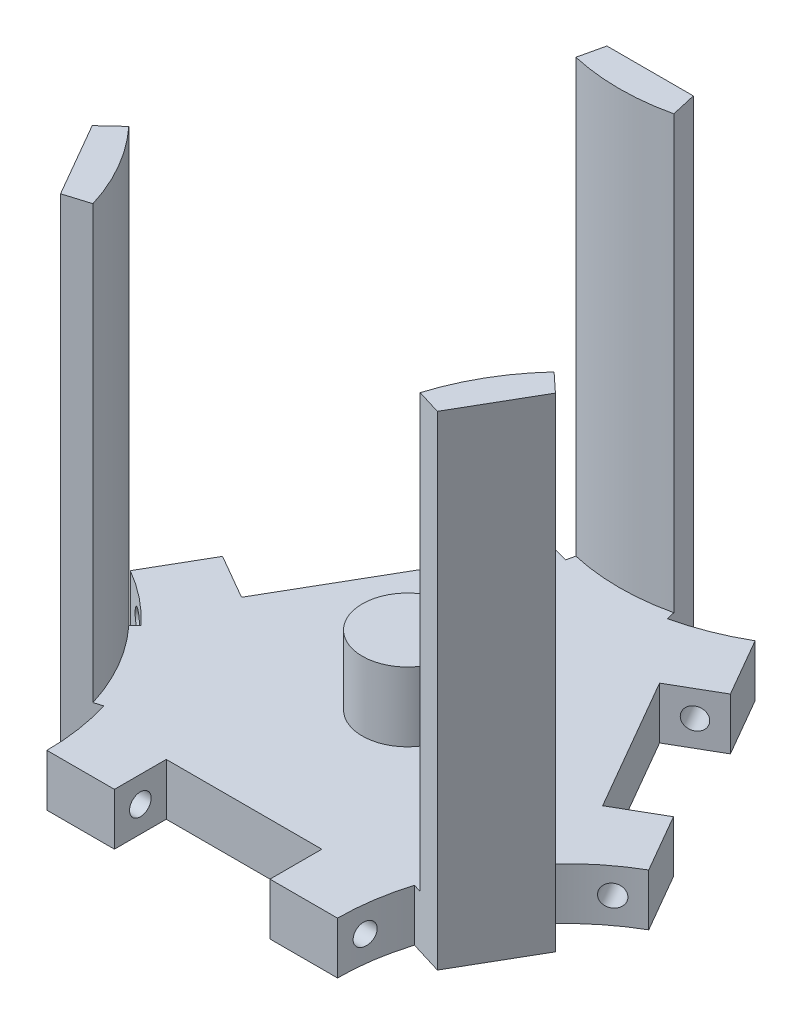
from build123d import *

# Parameters (mm, degrees)
BOSS_EXTRUDE1_DEPTH     = 3
SKETCH2_R               = 2.625
BOSS_EXTRUDE2_DEPTH     = 4
SKETCH3_W               = 9
SKETCH3_H               = 3
CUT_EXTRUDE1_DEPTH      = 46.717380795
CUT_EXTRUDE2_DEPTH      = 47.391760164
CUT_EXTRUDE2_DEPTH_BACK = 47.391760164
SKETCH4_R               = 0.625
CUT_EXTRUDE3_DEPTH      = 33.475581638
CUT_EXTRUDE3_DEPTH_BACK = 33.475581638
SKETCH5_R               = 0.625
CUT_EXTRUDE4_DEPTH      = 34.635958629
CUT_EXTRUDE4_DEPTH_BACK = 34.635958629
SKETCH6_R               = 0.625
BOSS_EXTRUDE3_DEPTH     = 25
SCALE1_SCALE            = 1.3


with BuildPart() as part:
    # Sketch1 → Boss-Extrude1 (new body)
    with BuildSketch(Plane(origin=(0, 0, 0), x_dir=(1, 0, 0), z_dir=(0, 1, 0))):
        with BuildLine():
            Line((6.591682084, 11.417128277), (15, 25.980762114))
            ThreePointArc((15, 25.980762114), (16.768876635, 25.128389411), (18.644755802, 24.548267761))
            Line((18.644755802, 24.548267761), (19.091682084, 26.497692522))
            Line((19.091682084, 26.497692522), (24.091682084, 26.497692522))
            Line((24.091682084, 26.497692522), (24.538608366, 24.548267761))
            ThreePointArc((24.538608366, 24.548267761), (26.414487532, 25.128389411), (28.183364168, 25.980762114))
            Line((28.183364168, 25.980762114), (36.591682084, 11.417128277))
            ThreePointArc((36.591682084, 11.417128277), (34.969067352, 10.311422526), (33.528727683, 8.976924338))
            Line((33.528727683, 8.976924338), (34.993515908, 7.615162444))
            Line((34.993515908, 7.615162444), (32.493515908, 3.285035425))
            Line((32.493515908, 3.285035425), (30.581801401, 3.872698291))
            ThreePointArc((30.581801401, 3.872698291), (30.146261903, 1.958078454), (30, 0))
            Line((30, 0), (13.183364168, 0))
            ThreePointArc((13.183364168, 0), (13.037102264, 1.958078454), (12.601562767, 3.872698291))
            Line((12.601562767, 3.872698291), (10.68984826, 3.285035425))
            Line((10.68984826, 3.285035425), (8.18984826, 7.615162444))
            Line((8.18984826, 7.615162444), (9.654636485, 8.976924338))
            ThreePointArc((9.654636485, 8.976924338), (8.214296816, 10.311422526), (6.591682084, 11.417128277))
        make_face()
    extrude(amount=BOSS_EXTRUDE1_DEPTH)

    # Sketch2 → Boss-Extrude2 (add)
    with BuildSketch(Plane(origin=(0, 3, 0), x_dir=(1, 0, 0), z_dir=(0, 1, 0))):
        with Locations(Location((21.591682084, 12.465963463, 0), (0, 0, 90))):
            Circle(SKETCH2_R)
    extrude(amount=BOSS_EXTRUDE2_DEPTH)

    # Sketch3 → Cut-Extrude1 (cut, through all)
    with BuildSketch(Plane.XZ):
        with Locations((21.591682084, -1.5)):
            Rectangle(SKETCH3_W, SKETCH3_H)
        Polygon((8.545841042, -14.801830878), (13.045841042, -22.596059512), (15.643917253, -21.096059512), (11.143917253, -13.301830878), align=None)
        Polygon((34.637523126, -14.801830878), (32.039446914, -13.301830878), (27.539446914, -21.096059512), (30.137523126, -22.596059512), align=None)
    extrude(amount=-CUT_EXTRUDE1_DEPTH, mode=Mode.SUBTRACT)

    # Sketch4 → Cut-Extrude2 (cut, two sides: drawn at the far end of the back side and taken through both)
    with BuildSketch(Plane(origin=(2.25, 0, 3.897114317), x_dir=(-0.8660254037844389, 0, 0.4999999999999997), z_dir=(-0.4999999999999997, 0, -0.8660254037844389)).offset(-CUT_EXTRUDE2_DEPTH_BACK)):
        with Locations((-35.89789039, 1.5)):
            Circle(SKETCH4_R)
    extrude(amount=CUT_EXTRUDE2_DEPTH + CUT_EXTRUDE2_DEPTH_BACK, mode=Mode.SUBTRACT)

    # Sketch5 → Cut-Extrude3 (cut, two sides: drawn at the far end of the back side and taken through both)
    with BuildSketch(Plane(origin=(8.545841042, 0, -14.801830878), x_dir=(-0.8660254037844383, 0, -0.5000000000000008), z_dir=(0.5000000000000007, 0, -0.8660254037844382)).offset(-CUT_EXTRUDE3_DEPTH_BACK)):
        with Locations((-1.5, 1.5)):
            Circle(SKETCH5_R)
    extrude(amount=CUT_EXTRUDE3_DEPTH + CUT_EXTRUDE3_DEPTH_BACK, mode=Mode.SUBTRACT)

    # Sketch6 → Cut-Extrude4 (cut, two sides: drawn at the far end of the back side and taken through both)
    with BuildSketch(Plane.ZY.offset(-26.091682084).offset(-CUT_EXTRUDE4_DEPTH_BACK)):
        with Locations((-1.5, 1.5)):
            Circle(SKETCH6_R)
    extrude(amount=CUT_EXTRUDE4_DEPTH + CUT_EXTRUDE4_DEPTH_BACK, mode=Mode.SUBTRACT)

    # Sketch7 → Boss-Extrude3 (add)
    with BuildSketch(Plane(origin=(0, 3, 0), x_dir=(1, 0, 0), z_dir=(0, 1, 0))):
        with BuildLine():
            Line((8.18984826, 7.615162444), (10.68984826, 3.285035425))
            Line((10.68984826, 3.285035425), (12.12363414, 3.725782575))
            ThreePointArc((12.12363414, 3.725782575), (10.983890093, 6.341551902), (9.288439429, 8.636483864))
            Line((9.288439429, 8.636483864), (8.18984826, 7.615162444))
        make_face()
        with BuildLine():
            Line((32.493515908, 3.285035425), (34.993515908, 7.615162444))
            Line((34.993515908, 7.615162444), (33.894924739, 8.636483864))
            ThreePointArc((33.894924739, 8.636483864), (32.199474075, 6.341551902), (31.059730028, 3.725782575))
            Line((31.059730028, 3.725782575), (32.493515908, 3.285035425))
        make_face()
        with BuildLine():
            Line((19.091682084, 26.497692522), (24.091682084, 26.497692522))
            Line((24.091682084, 26.497692522), (24.426876795, 25.035623951))
            ThreePointArc((24.426876795, 25.035623951), (21.591682084, 24.714786587), (18.756487372, 25.035623951))
            Line((18.756487372, 25.035623951), (19.091682084, 26.497692522))
        make_face()
    extrude(amount=BOSS_EXTRUDE3_DEPTH)


with BuildPart() as part_1:
    # Scale1: scaled about (21.591676284, 5.938563321, -12.465985005)
    add(part.part.scale(SCALE1_SCALE).moved(Location((-6.477502885, -1.781568996, 3.739795502))))


solid = part_1.part
